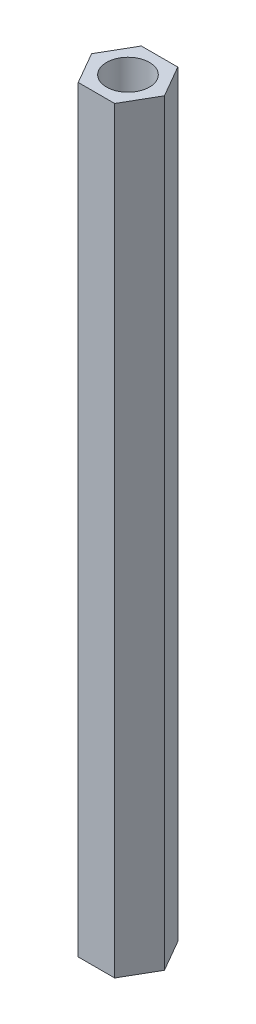
from build123d import *

# Parameters (mm, degrees)
SKETCH_1_R      = 1.7
EXTRUDE_1_DEPTH = 60


with BuildPart() as part:
    # 草图1 → 凸台-拉伸1 (new body)
    with BuildSketch(Plane(origin=(0, 0, 0), x_dir=(1, 0, 0), z_dir=(0, 1, 0))):
        Polygon((2.886751346, 0), (1.443375673, 2.5), (-1.443375673, 2.5), (-2.886751346, 0), (-1.443375673, -2.5), (1.443375673, -2.5), align=None)
        with Locations(Location((0, 0, 0), (0, 0, 270))):
            Circle(SKETCH_1_R, mode=Mode.SUBTRACT)
    extrude(amount=EXTRUDE_1_DEPTH)


solid = part.part
